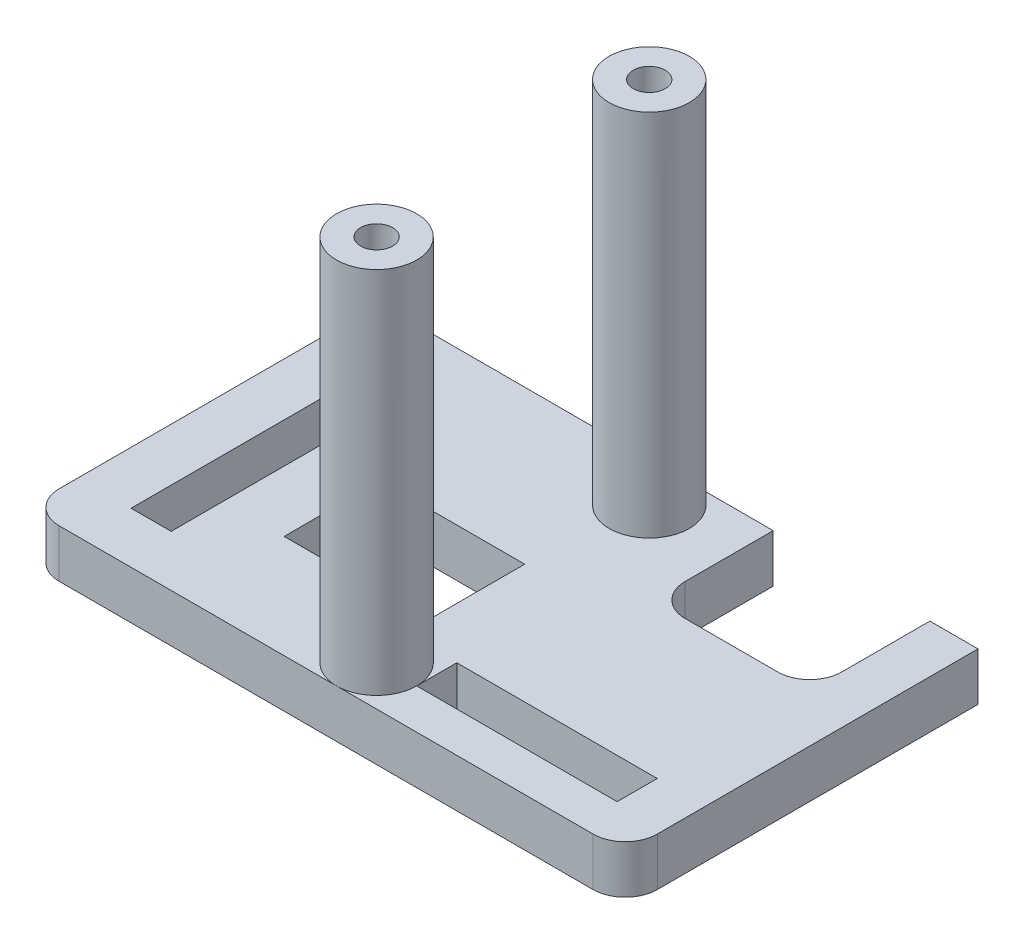
from build123d import *

# Parameters (mm, degrees)
SKETCH1_W           = 12.5
SKETCH1_H           = 2.5
SKETCH1_W_2         = 2.5
SKETCH1_H_2         = 12.5
SKETCH1_W_3         = 9
SKETCH1_H_3         = 6
BOSS_EXTRUDE1_DEPTH = 3
FILLET1_R           = 2
SKETCH1_6_R         = 2.5
BOSS_EXTRUDE4_DEPTH = 26
SKETCH3_R           = 1
CUT_EXTRUDE1_DEPTH  = 10


with BuildPart() as part:
    # Sketch1 → Boss-Extrude1 (new body)
    with BuildSketch(Plane(origin=(0, 0, 0), x_dir=(1, 0, 0), z_dir=(0, 1, 0))):
        Polygon((-38.561763486, -34.630037485), (-1.270220731, -34.630037485), (-1.270220731, -12.630037485), (-4.270220731, -12.630037485), (-4.270220731, -20.12144272), (-14.041444449, -20.12144272), (-14.041444449, -12.630037485), (-38.561763486, -12.630037485), align=None)
        with Locations((-10.520220731, -30.880037485)):
            Rectangle(SKETCH1_W, SKETCH1_H, mode=Mode.SUBTRACT)
        with Locations((-34.020220731, -25.190037485)):
            Rectangle(SKETCH1_W_2, SKETCH1_H_2, mode=Mode.SUBTRACT)
        with Locations((-24.475907507, -25.190037485)):
            Rectangle(SKETCH1_W_3, SKETCH1_H_3, mode=Mode.SUBTRACT)
    extrude(amount=BOSS_EXTRUDE1_DEPTH)

    # Fillet1
    fillet1_edges = [part.edges().sort_by_distance(p)[0] for p in [
        (-38.561763486, 1.5, 12.630037485),
        (-38.561763486, 1.5, 34.630037485),
        (-1.270220731, 1.5, 34.630037485),
        (-14.041444449, 1.5, 20.12144272),
        (-4.270220731, 1.5, 20.12144272),
    ]]
    fillet(fillet1_edges, radius=FILLET1_R)

    # Sketch1<6> → Boss-Extrude4 (add)
    with BuildSketch(Plane(origin=(0, 0, 0), x_dir=(1, 0, 0), z_dir=(0, 1, 0))):
        with Locations((-19.270220731, -15.130037485)):
            Circle(SKETCH1_6_R)
        with Locations((-19.270220731, -32.130037485)):
            Circle(SKETCH1_6_R)
    extrude(amount=BOSS_EXTRUDE4_DEPTH)

    # Sketch3 → Cut-Extrude1 (cut)
    with BuildSketch(Plane(origin=(0, 26, 0), x_dir=(1, 0, 0), z_dir=(0, 1, 0))):
        with Locations((-19.270220731, -32.130037485)):
            Circle(SKETCH3_R)
        with Locations((-19.270220731, -15.130037485)):
            Circle(SKETCH3_R)
    extrude(amount=-CUT_EXTRUDE1_DEPTH, mode=Mode.SUBTRACT)


solid = part.part
